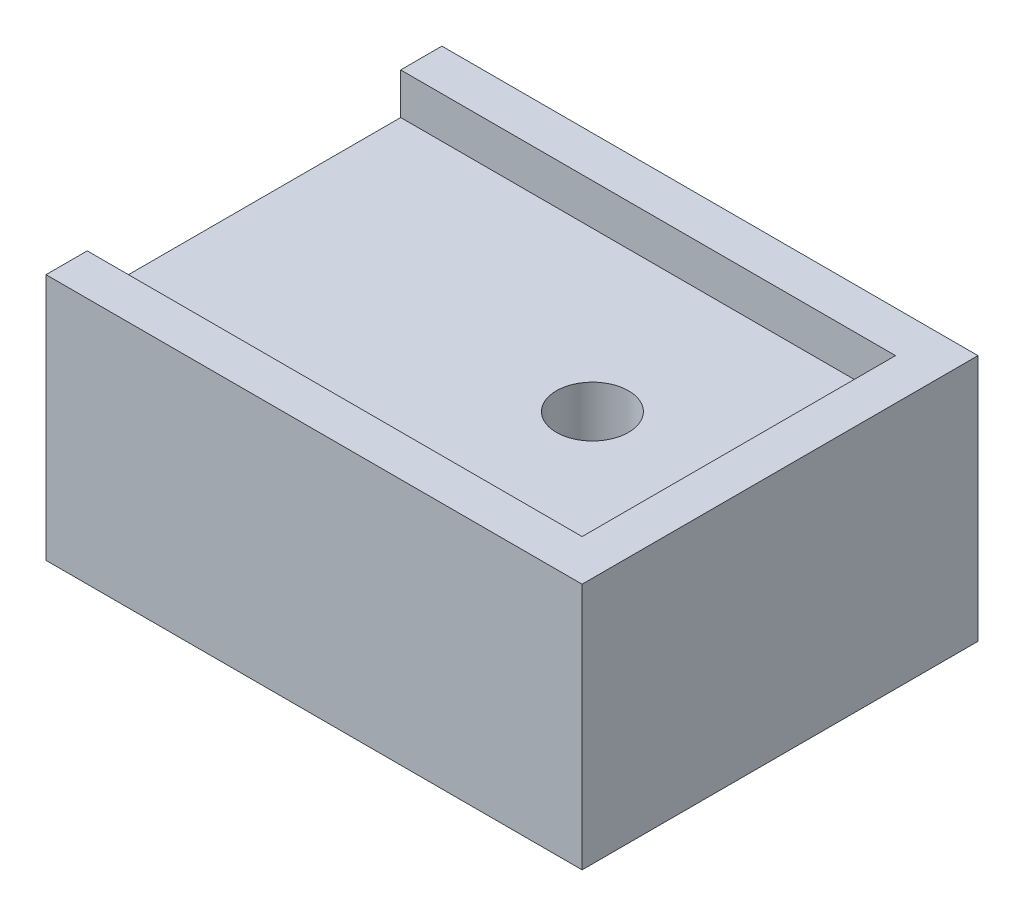
from build123d import *

# Parameters (mm, degrees)
SKETCH1_W           = 24
SKETCH1_H           = 15.2
BOSS_EXTRUDE1_DEPTH = 10
SKETCH3_R           = 1.75
CUT_EXTRUDE1_DEPTH  = 10
BOSS_EXTRUDE2_DEPTH = 12


with BuildPart() as part:
    # Sketch1 → Boss-Extrude1 (new body)
    with BuildSketch(Plane(origin=(0, 0, 0), x_dir=(1, 0, 0), z_dir=(0, 1, 0))):
        Rectangle(SKETCH1_W, SKETCH1_H)
    extrude(amount=BOSS_EXTRUDE1_DEPTH)

    # Sketch3 → Cut-Extrude1 (cut)
    with BuildSketch(Plane(origin=(0, 10, 0), x_dir=(1, 0, 0), z_dir=(0, 1, 0))):
        with Locations(Location((5, -0.1, 0), (0, 0, 270))):
            Circle(SKETCH3_R)
    extrude(amount=-CUT_EXTRUDE1_DEPTH, mode=Mode.SUBTRACT)

    # Sketch4 → Boss-Extrude2 (add)
    with BuildSketch(Plane(origin=(0, 0, 0), x_dir=(-1, 0, 0), z_dir=(0, -1, 0))):
        Polygon((12, -9.6), (12, -7.6), (-12, -7.6), (-12, 7.6), (12, 7.6), (12, 9.6), (-14, 9.6), (-14, -9.6), align=None)
    extrude(amount=-BOSS_EXTRUDE2_DEPTH)


solid = part.part
